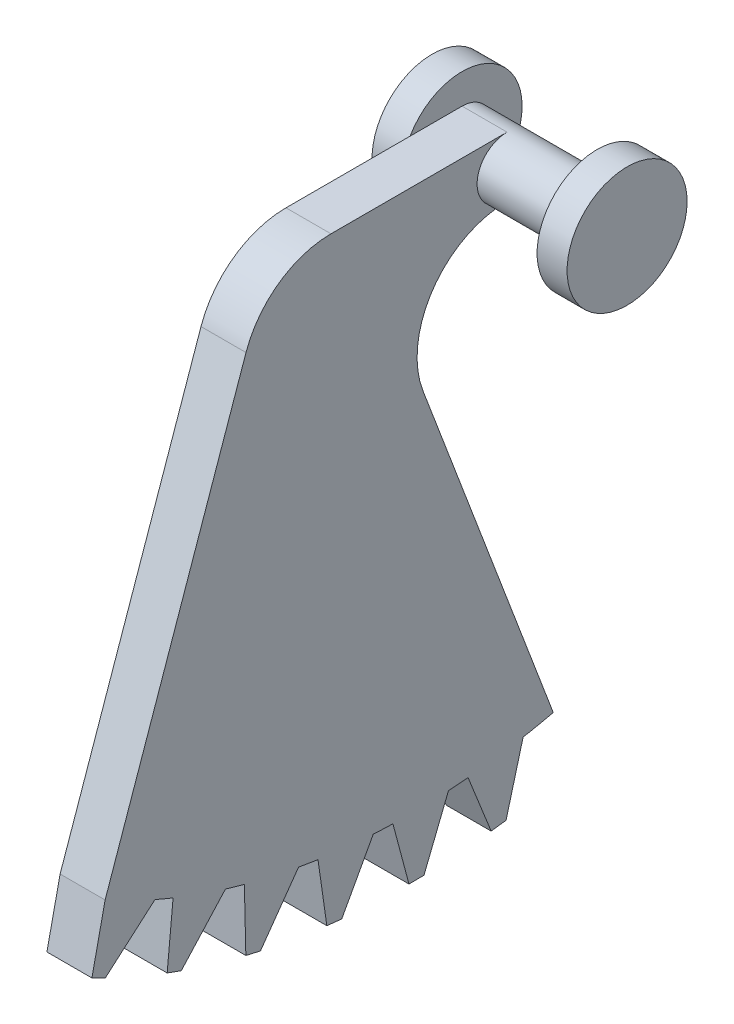
from build123d import *

# Parameters (mm, degrees)
SKETCH1_R           = 4
BOSS_EXTRUDE1_DEPTH = 2
BOSS_EXTRUDE2_START = -2
SKETCH1_3_R         = 2
BOSS_EXTRUDE2_DEPTH = 9
BOSS_EXTRUDE3_START = -11
SKETCH1_4_R         = 4
BOSS_EXTRUDE3_DEPTH = 2
BOSS_EXTRUDE4_START = 3
BOSS_EXTRUDE4_DEPTH = 3
FILLET1_R           = 6
BOSS_EXTRUDE5_START = 3
BOSS_EXTRUDE5_DEPTH = 3
CIRPATTERN1_COUNT   = 6
CIRPATTERN1_ANGLE   = 34


with BuildPart() as part:
    # Sketch1 → Boss-Extrude1 (new body)
    with BuildSketch(Plane.YZ):
        with Locations(Location((0, 0, 0), (0, 0, 270))):
            Circle(SKETCH1_R)
    extrude(amount=-BOSS_EXTRUDE1_DEPTH)

    # Sketch1<3> → Boss-Extrude2 (add)
    with BuildSketch(Plane.YZ.offset(BOSS_EXTRUDE2_START)):
        with Locations(Location((0, 0, 0), (0, 0, 270))):
            Circle(SKETCH1_3_R)
    extrude(amount=-BOSS_EXTRUDE2_DEPTH)

    # Sketch1<4> → Boss-Extrude3 (add)
    with BuildSketch(Plane.YZ.offset(BOSS_EXTRUDE3_START)):
        with Locations(Location((0, 0, 0), (0, 0, 270))):
            Circle(SKETCH1_4_R)
    extrude(amount=-BOSS_EXTRUDE3_DEPTH)

    # Sketch2 → Boss-Extrude4 (add)
    with BuildSketch(Plane.YZ.offset(-11).offset(BOSS_EXTRUDE4_START)):
        with BuildLine():
            Line((2, 0), (2, 16))
            Line((2, 16), (-28.931042314, 26.795547064))
            ThreePointArc((-28.931042314, 26.795547064), (-29.786171027, 25.152339202), (-30.568468217, 23.473235781))
            ThreePointArc((-30.568468217, 23.473235781), (-33.95702666, 10.398285565), (-33.047270986, -3.077952637))
            Line((-33.047270986, -3.077952637), (-10.126725467, 5.61044016))
            ThreePointArc((-10.126725467, 5.61044016), (-4.591213765, 4.937628621), (-2, 0))
            ThreePointArc((-2, 0), (0, 2), (2, 0))
        make_face()
    extrude(amount=-BOSS_EXTRUDE4_DEPTH)

    # Fillet1
    fillet1_edges = [part.edges().sort_by_distance(p)[0] for p in [
        (-9.5, 2, 16),
    ]]
    fillet(fillet1_edges, radius=FILLET1_R)

    # Sketch2<3> → Boss-Extrude5 (add)
    with BuildSketch(Plane.YZ.offset(-11).offset(BOSS_EXTRUDE5_START)):
        with BuildLine():
            ThreePointArc((-30.568468217, 23.473235781), (-29.786171027, 25.152339202), (-28.931042314, 26.795547064))
            Line((-28.931042314, 26.795547064), (-32.992813147, 27.676701657))
            Line((-32.992813147, 27.676701657), (-33.441604676, 26.783065174))
            Line((-33.441604676, 26.783065174), (-30.568468217, 23.473235781))
        make_face()
    boss_extrude5 = extrude(amount=-BOSS_EXTRUDE5_DEPTH)

    # CirPattern1: Boss-Extrude5 ×6 about axis
    cirpattern1_axis = Axis((0, 8.12, 6.47), (1, 0, 0))
    for i in range(1, CIRPATTERN1_COUNT):
        add(boss_extrude5.rotate(cirpattern1_axis, i * CIRPATTERN1_ANGLE / (CIRPATTERN1_COUNT - 1)))


solid = part.part
